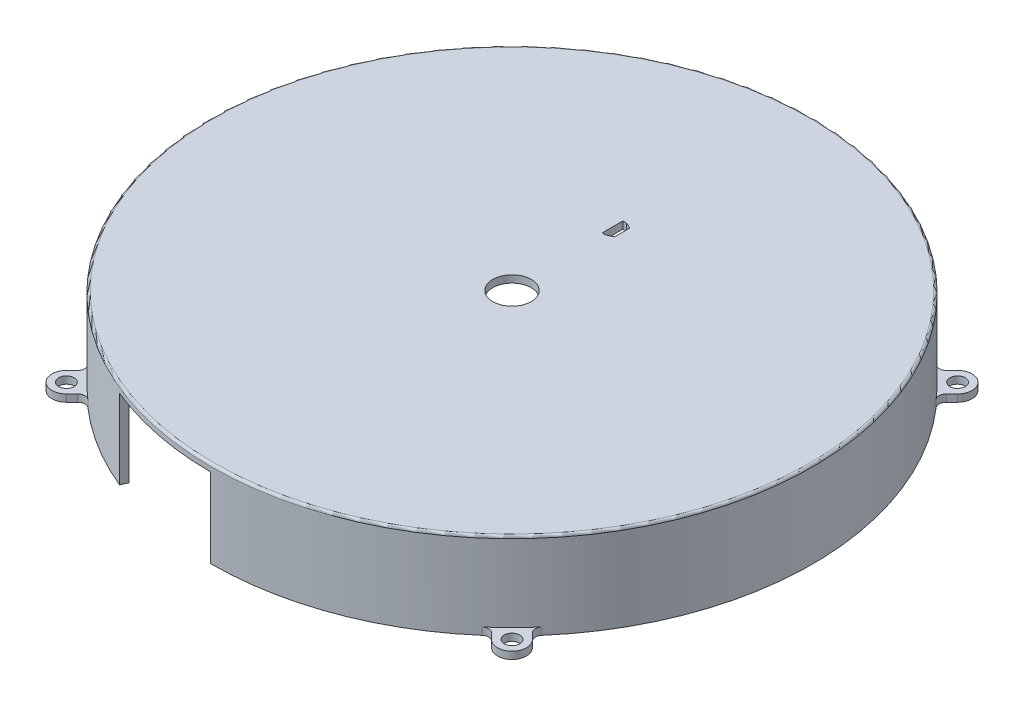
from build123d import *

# Parameters (mm, degrees)
EXTRUDE_1_DEPTH = 16.5
SKETCH_2_R      = 4
EXTRUDE_2_DEPTH = 1.5
FILLET_1_R      = 0.5
SKETCH_3_R      = 1.6
EXTRUDE_4_DEPTH = 1.5
FILLET_2_R      = 1.5


with BuildPart() as part:
    # Эскиз1 → Бобышка-Вытянуть1 (new body)
    with BuildSketch(Plane(origin=(0, 0, 0), x_dir=(1, 0, 0), z_dir=(0, 1, 0))):
        with BuildLine():
            Line((-23.77906371, -57.799706998), (-23.205036867, -56.41388361))
            ThreePointArc((-23.205036867, -56.41388361), (11.826941696, 59.842488669), (0, -61))
            Line((0, -61), (-0.15, -61))
            Line((-0.15, -61), (-0.15, -62.49982))
            ThreePointArc((-0.15, -62.49982), (12.193145126, 61.299080025), (-23.77906371, -57.799706998))
        make_face()
    extrude(amount=EXTRUDE_1_DEPTH)

    # Эскиз2 → Бобышка-Вытянуть2 (add)
    # profile 1 of 2: a face of its own
    with BuildSketch(Plane(origin=(0, 16.5, 0), x_dir=(1, 0, 0), z_dir=(0, 1, 0))):
        with BuildLine():
            Line((0, -61), (-0.15, -61))
            Line((-0.15, -61), (-0.15, -62.49982))
            ThreePointArc((-0.15, -62.49982), (12.193145126, 61.299080025), (-23.77906371, -57.799706998))
            Line((-23.77906371, -57.799706998), (-23.205036867, -56.41388361))
            ThreePointArc((-23.205036867, -56.41388361), (11.826941696, 59.842488669), (0, -61))
        make_face()
    # profile 2 of 2: a face of its own
    with BuildSketch(Plane(origin=(0, 16.5, 0), x_dir=(1, 0, 0), z_dir=(0, 1, 0))):
        with BuildLine():
            Line((-23.205036867, -56.41388361), (-23.77906371, -57.799706998))
            ThreePointArc((-23.77906371, -57.799706998), (-12.193145126, -61.299080025), (-0.15, -62.49982))
            Line((-0.15, -62.49982), (-0.15, -61))
            Line((-0.15, -61), (0, -61))
            ThreePointArc((0, -61), (11.826941696, 59.842488669), (-23.205036867, -56.41388361))
        make_face()
        with Locations(Location((0, 0, 0), (0, 0, 270))):
            Circle(SKETCH_2_R, mode=Mode.SUBTRACT)
        Polygon((-1, 23.5), (-1, 24.05), (-0.25, 24.05), (1, 23.5), (1, 20.3), (-0.25, 19.75), (-1, 19.75), (-1, 20.3), align=None, mode=Mode.SUBTRACT)
    extrude(amount=EXTRUDE_2_DEPTH)

    # Скругление1
    fillet_1_edges = [part.edges().sort_by_distance(p)[0] for p in [
        (23.77906371, 18, -57.799706998),
    ]]
    fillet(fillet_1_edges, radius=FILLET_1_R)

    # Эскиз3 → Бобышка-Вытянуть4 (add)
    # profile 1 of 4: a face of its own
    with BuildSketch(Plane.XZ):
        with BuildLine():
            Line((-42.021912433, 46.264553121), (-44.194173824, 48.436814511))
            ThreePointArc((-44.194173824, 48.436814511), (-48.436814511, 48.436814511), (-48.436814511, 44.194173824))
            Line((-48.436814511, 44.194173824), (-46.264553121, 42.021912433))
            ThreePointArc((-46.264553121, 42.021912433), (-44.194173824, 44.194173824), (-42.021912433, 46.264553121))
        make_face()
        with Locations(Location((-46.315494168, 46.315494168, 0), (0, 0, 270))):
            Circle(SKETCH_3_R, mode=Mode.SUBTRACT)
    # profile 2 of 4: a face of its own
    with BuildSketch(Plane.XZ):
        with BuildLine():
            Line((44.194173824, 48.436814511), (42.021912433, 46.264553121))
            ThreePointArc((42.021912433, 46.264553121), (44.194173824, 44.194173824), (46.264553121, 42.021912433))
            Line((46.264553121, 42.021912433), (48.436814511, 44.194173824))
            ThreePointArc((48.436814511, 44.194173824), (48.436814511, 48.436814511), (44.194173824, 48.436814511))
        make_face()
        with Locations(Location((46.315494168, 46.315494168, 0), (0, 0, 270))):
            Circle(SKETCH_3_R, mode=Mode.SUBTRACT)
    # profile 3 of 4: a face of its own
    with BuildSketch(Plane.XZ):
        with BuildLine():
            ThreePointArc((-42.021912433, -46.264553121), (-44.194173824, -44.194173824), (-46.264553121, -42.021912433))
            Line((-46.264553121, -42.021912433), (-48.436814511, -44.194173824))
            ThreePointArc((-48.436814511, -44.194173824), (-48.436814511, -48.436814511), (-44.194173824, -48.436814511))
            Line((-44.194173824, -48.436814511), (-42.021912433, -46.264553121))
        make_face()
        with Locations(Location((-46.315494168, -46.315494168, 0), (0, 0, 270))):
            Circle(SKETCH_3_R, mode=Mode.SUBTRACT)
    # profile 4 of 4: a face of its own
    with BuildSketch(Plane.XZ):
        with BuildLine():
            ThreePointArc((46.264553121, -42.021912433), (44.194173824, -44.194173824), (42.021912433, -46.264553121))
            Line((42.021912433, -46.264553121), (44.194173824, -48.436814511))
            ThreePointArc((44.194173824, -48.436814511), (48.436814511, -48.436814511), (48.436814511, -44.194173824))
            Line((48.436814511, -44.194173824), (46.264553121, -42.021912433))
        make_face()
        with Locations(Location((46.315494168, -46.315494168, 0), (0, 0, 270))):
            Circle(SKETCH_3_R, mode=Mode.SUBTRACT)
    extrude(amount=-EXTRUDE_4_DEPTH)

    # Скругление2
    fillet_2_edges = [part.edges().sort_by_distance(p)[0] for p in [
        (-42.021912433, 0.75, 46.264553121),
        (-46.264553121, 0.75, 42.021912433),
        (46.264553121, 0.75, 42.021912433),
        (42.021912433, 0.75, 46.264553121),
        (-46.264553121, 0.75, -42.021912433),
        (-42.021912433, 0.75, -46.264553121),
        (42.021912433, 0.75, -46.264553121),
        (46.264553121, 0.75, -42.021912433),
    ]]
    fillet(fillet_2_edges, radius=FILLET_2_R)


solid = part.part
